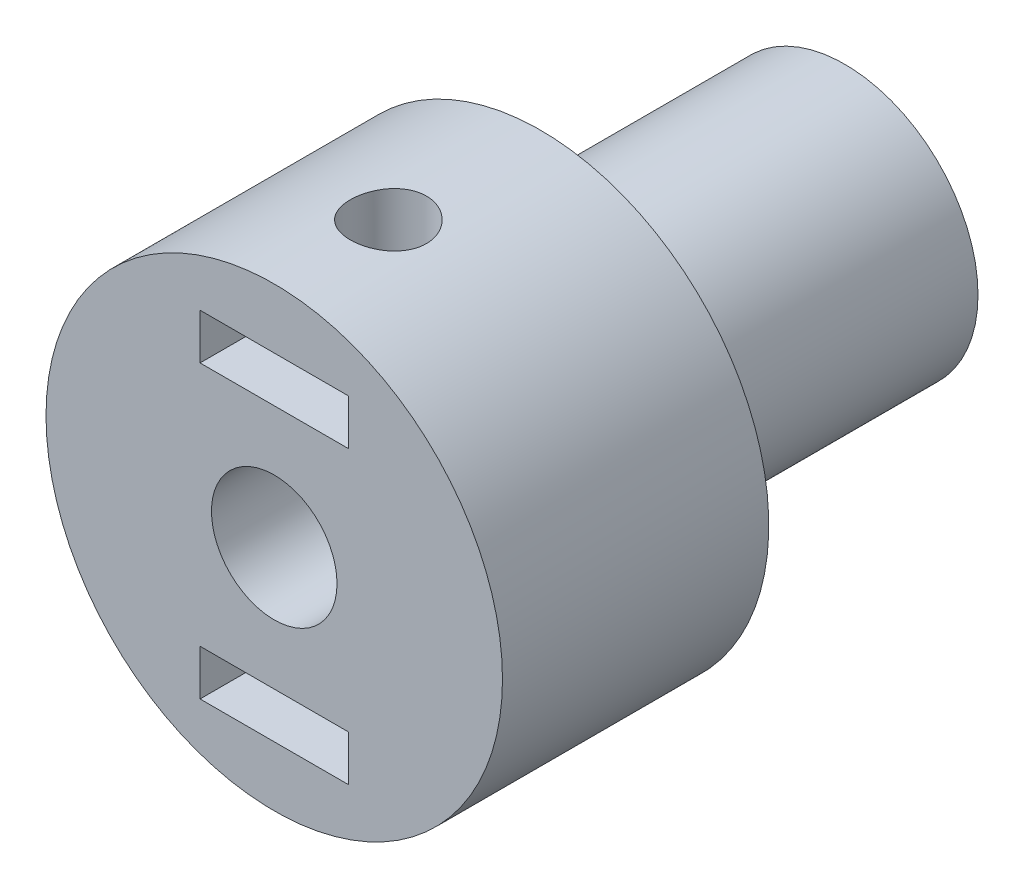
from build123d import *

# Parameters (mm, degrees)
SKETCH1_R           = 6
BOSS_EXTRUDE1_DEPTH = 15
SKETCH2_R           = 1.65
CUT_EXTRUDE1_DEPTH  = 18.23368794
SKETCH13_W          = 3.9
SKETCH13_H          = 1.2
CUT_EXTRUDE6_DEPTH  = 4.95
SKETCH4_R           = 1
CUT_EXTRUDE7_DEPTH  = 7.5
SKETCH19_R          = 6
SKETCH19_R_2        = 5.5
SKETCH19_R_3        = 3.5
CUT_EXTRUDE12_DEPTH = 8


with BuildPart() as part:
    # Sketch1 → Boss-Extrude1 (new body)
    with BuildSketch(Plane.XY):
        Circle(SKETCH1_R)
    extrude(amount=BOSS_EXTRUDE1_DEPTH)

    # Sketch2 → Cut-Extrude1 (cut, through all)
    with BuildSketch(Plane.XY.offset(15)):
        Circle(SKETCH2_R)
    extrude(amount=-CUT_EXTRUDE1_DEPTH, mode=Mode.SUBTRACT)

    # Sketch13 → Cut-Extrude6 (cut)
    with BuildSketch(Plane.XY.offset(15)):
        with Locations((0, 3.825)):
            Rectangle(SKETCH13_W, SKETCH13_H)
    cut_extrude6 = extrude(amount=-CUT_EXTRUDE6_DEPTH, mode=Mode.SUBTRACT)

    # Sketch4 → Cut-Extrude7 (cut, symmetric)
    with BuildSketch(Plane(origin=(0, 0, 0), x_dir=(1, 0, 0), z_dir=(0, 1, 0))):
        with Locations(Location((0, -12, 0), (0, 0, 270))):
            Circle(SKETCH4_R)
    extrude(amount=CUT_EXTRUDE7_DEPTH, both=True, mode=Mode.SUBTRACT)

    # Mirror1: Cut-Extrude6 across plane
    add(cut_extrude6.mirror(Plane.ZX), mode=Mode.SUBTRACT)

    # Sketch19 → Cut-Extrude12 (cut)
    # profile 1 of 2: a face of its own
    with BuildSketch(Plane(origin=(0, 0, 0), x_dir=(-1, 0, 0), z_dir=(0, 0, -1))):
        Circle(SKETCH19_R)
        Circle(SKETCH19_R_2, mode=Mode.SUBTRACT)
    # profile 2 of 2: a face of its own
    with BuildSketch(Plane(origin=(0, 0, 0), x_dir=(-1, 0, 0), z_dir=(0, 0, -1))):
        Circle(SKETCH19_R_2)
        Circle(SKETCH19_R_3, mode=Mode.SUBTRACT)
    extrude(amount=-CUT_EXTRUDE12_DEPTH, mode=Mode.SUBTRACT)


solid = part.part
